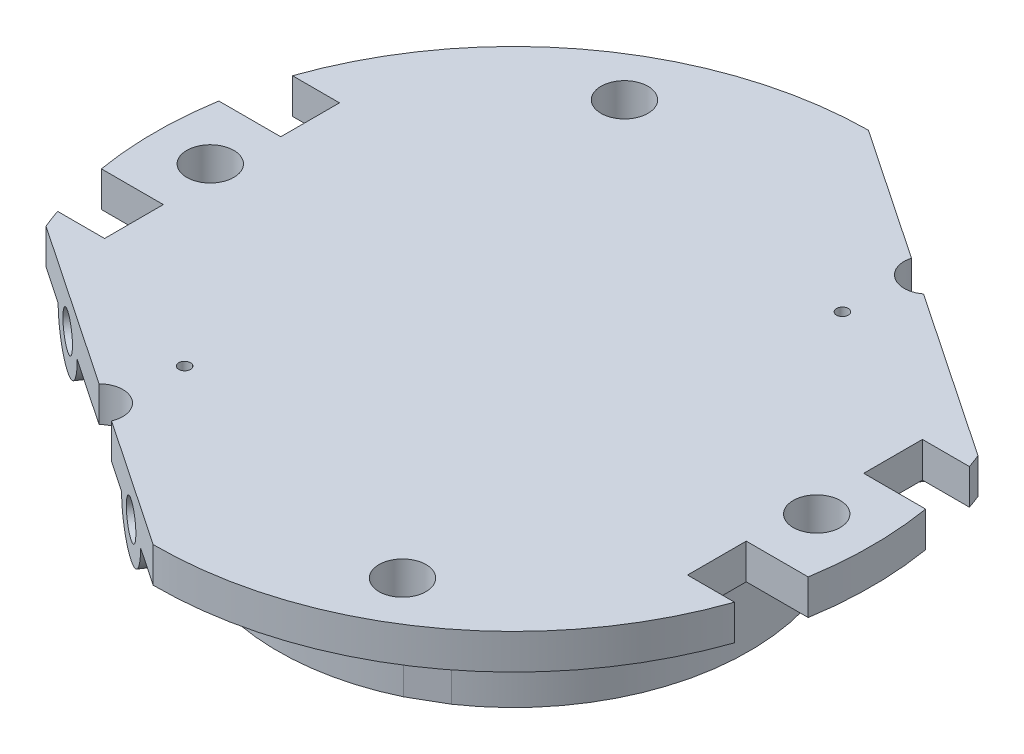
from build123d import *

# Parameters (mm, degrees)
CROQUIS1_R              = 30.5
SALIENTE_EXTRUIR1_DEPTH = 3
CORTAR_EXTRUIR3_START   = -4
CORTAR_EXTRUIR3_DEPTH   = 4
CORTAR_EXTRUIR4_DEPTH   = 10
CROQUIS8_R              = 0.5
CORTAR_EXTRUIR5_DEPTH   = 3
SALIENTE_EXTRUIR2_DEPTH = 13
CROQUIS11_W             = 34.583232932
CROQUIS11_H             = 3
SALIENTE_EXTRUIR3_DEPTH = 6
CROQUIS12_R             = 2
CORTAR_EXTRUIR7_DEPTH   = 3
SALIENTE_EXTRUIR4_DEPTH = 20
CROQUIS14_R             = 1.5
CORTAR_EXTRUIR8_DEPTH   = 6
CORTAR_EXTRUIR9_START   = -3
CORTAR_EXTRUIR9_DEPTH   = 3
CROQUIS16_W             = 33.68877148
CROQUIS16_H             = 3
SALIENTE_EXTRUIR5_DEPTH = 6
CROQUIS17_R             = 2
CORTAR_EXTRUIR10_DEPTH  = 3
CROQUIS18_R             = 3
SALIENTE_EXTRUIR6_DEPTH = 25
CROQUIS19_R             = 1.5
CORTAR_EXTRUIR11_DEPTH  = 5
CORTAR_EXTRUIR12_DEPTH  = 6
CORTAR_EXTRUIR13_DEPTH  = 6
CROQUIS22_R             = 1.5
CORTAR_EXTRUIR14_DEPTH  = 6
CROQUIS23_R             = 1.5
CORTAR_EXTRUIR15_DEPTH  = 6


with BuildPart() as part:
    # Croquis1 → Saliente-Extruir1 (new body)
    with BuildSketch(Plane(origin=(0, 0, 0), x_dir=(1, 0, 0), z_dir=(0, 1, 0))):
        with Locations(Location((0, 0, 0), (0, 0, 270))):
            Circle(CROQUIS1_R)
    extrude(amount=SALIENTE_EXTRUIR1_DEPTH)

    # Croquis5 → Cortar-Extruir3 (cut)
    with BuildSketch(Plane(origin=(0, 3, 0), x_dir=(1, 0, 0), z_dir=(0, 1, 0)).offset(CORTAR_EXTRUIR3_START)):
        with BuildLine():
            ThreePointArc((-30.087372767, -5), (-29.556634924, -7.526973624), (-28.814059068, -10))
            Line((-28.814059068, -10), (-24.814059068, -10))
            Line((-24.814059068, -10), (-24.814059068, -5))
            Line((-24.814059068, -5), (-28.814059068, -5))
            Line((-28.814059068, -5), (-30.087372767, -5))
        make_face()
        with BuildLine():
            ThreePointArc((-28.814059068, 10), (-29.556634924, 7.526973624), (-30.087372767, 5))
            Line((-30.087372767, 5), (-28.814059068, 5))
            Line((-28.814059068, 5), (-24.814059068, 5))
            Line((-24.814059068, 5), (-24.814059068, 10))
            Line((-24.814059068, 10), (-28.814059068, 10))
        make_face()
        with BuildLine():
            Line((28.814059068, 5), (30.087372767, 5))
            ThreePointArc((30.087372767, 5), (29.556634924, 7.526973624), (28.814059068, 10))
            Line((28.814059068, 10), (24.814059068, 10))
            Line((24.814059068, 10), (24.814059068, 5))
            Line((24.814059068, 5), (28.814059068, 5))
        make_face()
        with BuildLine():
            Line((30.087372767, -5), (28.814059068, -5))
            Line((28.814059068, -5), (24.814059068, -5))
            Line((24.814059068, -5), (24.814059068, -10))
            Line((24.814059068, -10), (28.814059068, -10))
            ThreePointArc((28.814059068, -10), (29.556634924, -7.526973624), (30.087372767, -5))
        make_face()
    extrude(amount=CORTAR_EXTRUIR3_DEPTH, mode=Mode.SUBTRACT)

    # Croquis7 → Cortar-Extruir4 (cut)
    with BuildSketch(Plane(origin=(0, 3, 0), x_dir=(1, 0, 0), z_dir=(0, 1, 0))):
        with BuildLine():
            ThreePointArc((-13.907029535, 20.623580122), (-11.907029535, 20.623580122), (-10.907029535, 22.355630929))
            Line((-10.907029535, 22.355630929), (-12.907029535, 22.355630929))
            Line((-12.907029535, 22.355630929), (-13.907029535, 20.623580122))
        make_face()
        with BuildLine():
            Line((-12.907029535, 22.355630929), (-10.907029535, 22.355630929))
            ThreePointArc((-10.907029535, 22.355630929), (-13.907029535, 24.087681737), (-13.907029535, 20.623580122))
            Line((-13.907029535, 20.623580122), (-12.907029535, 22.355630929))
        make_face()
        with BuildLine():
            ThreePointArc((-23.81405907, 0), (-24.082008262, 1), (-24.81405907, 1.732050808))
            Line((-24.81405907, 1.732050808), (-25.81405907, 0))
            Line((-25.81405907, 0), (-24.81405907, -1.732050808))
            ThreePointArc((-24.81405907, -1.732050808), (-24.082008262, -1), (-23.81405907, 0))
        make_face()
        with BuildLine():
            Line((-25.81405907, 0), (-24.81405907, 1.732050808))
            ThreePointArc((-24.81405907, 1.732050808), (-27.81405907, 0), (-24.81405907, -1.732050808))
            Line((-24.81405907, -1.732050808), (-25.81405907, 0))
        make_face()
        with BuildLine():
            ThreePointArc((10.907029535, 22.355630929), (11.907029535, 20.623580122), (13.907029535, 20.623580122))
            Line((13.907029535, 20.623580122), (12.907029535, 22.355630929))
            Line((12.907029535, 22.355630929), (10.907029535, 22.355630929))
        make_face()
        with BuildLine():
            Line((12.907029535, 22.355630929), (13.907029535, 20.623580122))
            ThreePointArc((13.907029535, 20.623580122), (14.639080343, 21.355630929), (14.907029535, 22.355630929))
            ThreePointArc((14.907029535, 22.355630929), (12.907029535, 24.355630929), (10.907029535, 22.355630929))
            Line((10.907029535, 22.355630929), (12.907029535, 22.355630929))
        make_face()
        with BuildLine():
            Line((24.81405907, -1.732050808), (25.81405907, 0))
            Line((25.81405907, 0), (24.81405907, 1.732050808))
            ThreePointArc((24.81405907, 1.732050808), (23.81405907, 0), (24.81405907, -1.732050808))
        make_face()
        with BuildLine():
            Line((24.81405907, 1.732050808), (25.81405907, 0))
            Line((25.81405907, 0), (24.81405907, -1.732050808))
            ThreePointArc((24.81405907, -1.732050808), (26.81405907, -1.732050808), (27.81405907, 0))
            ThreePointArc((27.81405907, 0), (26.81405907, 1.732050808), (24.81405907, 1.732050808))
        make_face()
        with BuildLine():
            ThreePointArc((-13.907029535, -20.623580122), (-13.907029535, -24.087681737), (-10.907029535, -22.355630929))
            Line((-10.907029535, -22.355630929), (-12.907029535, -22.355630929))
            Line((-12.907029535, -22.355630929), (-13.907029535, -20.623580122))
        make_face()
        with BuildLine():
            Line((-12.907029535, -22.355630929), (-10.907029535, -22.355630929))
            ThreePointArc((-10.907029535, -22.355630929), (-11.907029535, -20.623580122), (-13.907029535, -20.623580122))
            Line((-13.907029535, -20.623580122), (-12.907029535, -22.355630929))
        make_face()
        with BuildLine():
            ThreePointArc((14.907029535, -22.355630929), (14.639080343, -21.355630929), (13.907029535, -20.623580122))
            Line((13.907029535, -20.623580122), (12.907029535, -22.355630929))
            Line((12.907029535, -22.355630929), (10.907029535, -22.355630929))
            ThreePointArc((10.907029535, -22.355630929), (12.907029535, -24.355630929), (14.907029535, -22.355630929))
        make_face()
        with BuildLine():
            Line((12.907029535, -22.355630929), (13.907029535, -20.623580122))
            ThreePointArc((13.907029535, -20.623580122), (11.907029535, -20.623580122), (10.907029535, -22.355630929))
            Line((10.907029535, -22.355630929), (12.907029535, -22.355630929))
        make_face()
    extrude(amount=-CORTAR_EXTRUIR4_DEPTH, mode=Mode.SUBTRACT)

    # Croquis8 → Cortar-Extruir5 (cut)
    with BuildSketch(Plane(origin=(0, 3, 0), x_dir=(1, 0, 0), z_dir=(0, 1, 0))):
        with Locations(Location((12, 16, 0), (0, 0, 270))):
            Circle(CROQUIS8_R)
        with Locations(Location((-12, -16, 0), (0, 0, 270))):
            Circle(CROQUIS8_R)
    extrude(amount=-CORTAR_EXTRUIR5_DEPTH, mode=Mode.SUBTRACT)

    # Croquis9 → Saliente-Extruir2 (add)
    with BuildSketch(Plane(origin=(0, 3, 0), x_dir=(1, 0, 0), z_dir=(0, 1, 0))):
        with BuildLine():
            Line((-8.700961894, 18.070508076), (-10, 17.320508076))
            Line((-10, 17.320508076), (-11.299038106, 16.570508076))
            ThreePointArc((-11.299038106, 16.570508076), (-19.960969499, 1.951844427), (-14.294950117, -14.067849912))
            ThreePointArc((-14.294950117, -14.067849912), (-10.97161543, -13.181769141), (-9, -16))
            ThreePointArc((-9, -16), (-9.12838457, -16.868230859), (-9.502549883, -17.662150088))
            ThreePointArc((-9.502549883, -17.662150088), (-0.449805389, -20.05112653), (8.700961894, -18.070508076))
            Line((8.700961894, -18.070508076), (10, -17.320508076))
            Line((10, -17.320508076), (11.299038106, -16.570508076))
            ThreePointArc((11.299038106, -16.570508076), (17.732250869, -9.371087404), (20.05617112, 0))
            ThreePointArc((20.05617112, 0), (18.560064193, 7.600922125), (14.294950117, 14.067849912))
            ThreePointArc((14.294950117, 14.067849912), (10.2, 13.6), (9.502549883, 17.662150088))
            ThreePointArc((9.502549883, 17.662150088), (0.449805389, 20.05112653), (-8.700961894, 18.070508076))
        make_face()
    extrude(amount=-SALIENTE_EXTRUIR2_DEPTH)

    # Croquis11 → Saliente-Extruir3 (add)
    with BuildSketch(Plane(origin=(14.04954782, 0, -20.829311224), x_dir=(-0.8290375725550414, 0, -0.5591929034707472), z_dir=(0.5591929034707472, 0, -0.8290375725550414))):
        with Locations((0, 1.5)):
            Rectangle(CROQUIS11_W, CROQUIS11_H)
    extrude(amount=SALIENTE_EXTRUIR3_DEPTH)

    # Croquis12 → Cortar-Extruir7 (cut)
    with BuildSketch(Plane(origin=(0, 3, 0), x_dir=(1, 0, 0), z_dir=(0, 1, 0))):
        with Locations(Location((12.907029535, 22.355630929, 0), (0, 0, 270))):
            Circle(CROQUIS12_R)
    extrude(amount=-CORTAR_EXTRUIR7_DEPTH, mode=Mode.SUBTRACT)

    # Croquis13 → Saliente-Extruir4 (add)
    with BuildSketch(Plane(origin=(17.404705241, 0, -25.803536659), x_dir=(-0.8290375725550414, 0, -0.5591929034707472), z_dir=(0.5591929034707472, 0, -0.8290375725550414))):
        with BuildLine():
            ThreePointArc((10, 3), (7.878679656, 2.121320344), (7, 0))
            Line((7, 0), (8.5, 0))
            ThreePointArc((8.5, 0), (10, 1.5), (11.5, 0))
            Line((11.5, 0), (13, 0))
            ThreePointArc((13, 0), (12.121320344, 2.121320344), (10, 3))
        make_face()
        with BuildLine():
            Line((8.5, 0), (7, 0))
            ThreePointArc((7, 0), (10, -3), (13, 0))
            Line((13, 0), (11.5, 0))
            ThreePointArc((11.5, 0), (10, -1.5), (8.5, 0))
        make_face()
        with BuildLine():
            ThreePointArc((-11.5, 0), (-10, 1.5), (-8.5, 0))
            Line((-8.5, 0), (-7, 0))
            ThreePointArc((-7, 0), (-7.878679656, 2.121320343), (-9.999999999, 3))
            ThreePointArc((-9.999999999, 3), (-12.121320343, 2.121320344), (-13, 0))
            Line((-13, 0), (-11.5, 0))
        make_face()
        with BuildLine():
            Line((-7, 0), (-8.5, 0))
            ThreePointArc((-8.5, 0), (-10, -1.5), (-11.5, 0))
            Line((-11.5, 0), (-13, 0))
            ThreePointArc((-13, 0), (-10, -3), (-7, 0))
        make_face()
        with BuildLine():
            ThreePointArc((-11.5, 0), (-10, -1.5), (-8.5, 0))
            Line((-8.5, 0), (-11.5, 0))
        make_face()
        with BuildLine():
            Line((-11.5, 0), (-8.5, 0))
            ThreePointArc((-8.5, 0), (-10, 1.5), (-11.5, 0))
        make_face()
        with BuildLine():
            ThreePointArc((11.5, 0), (10, 1.5), (8.5, 0))
            Line((8.5, 0), (11.5, 0))
        make_face()
        with BuildLine():
            Line((11.5, 0), (8.5, 0))
            ThreePointArc((8.5, 0), (10, -1.5), (11.5, 0))
        make_face()
    extrude(amount=-SALIENTE_EXTRUIR4_DEPTH)

    # Croquis14 → Cortar-Extruir8 (cut)
    with BuildSketch(Plane(origin=(17.404705241, 0, -25.803536659), x_dir=(-0.8290375725550414, 0, -0.5591929034707472), z_dir=(0.5591929034707472, 0, -0.8290375725550414))):
        with Locations((-10, 0)):
            Circle(CROQUIS14_R)
        with Locations((10, 0)):
            Circle(CROQUIS14_R)
    extrude(amount=-CORTAR_EXTRUIR8_DEPTH, mode=Mode.SUBTRACT)

    # Croquis15 → Cortar-Extruir9 (cut)
    with BuildSketch(Plane(origin=(0, 3, 0), x_dir=(1, 0, 0), z_dir=(0, 1, 0)).offset(CORTAR_EXTRUIR9_START)):
        with BuildLine():
            ThreePointArc((-28.212513648, -11.588963441), (-17.055383556, -25.285645963), (-0.176506165, -30.499489267))
            Line((-0.176506165, -30.499489267), (-11.071782568, -23.15053254))
            ThreePointArc((-11.071782568, -23.15053254), (-14.025415342, -24.013706075), (-14.331545089, -20.951794957))
            Line((-14.331545089, -20.951794957), (-28.212513648, -11.588963441))
        make_face()
    extrude(amount=CORTAR_EXTRUIR9_DEPTH, mode=Mode.SUBTRACT)

    # Croquis16 → Saliente-Extruir5 (add)
    with BuildSketch(Plane(origin=(-14.194509906, 0, 21.044226354), x_dir=(0.8290375725550415, 0, 0.5591929034707472), z_dir=(-0.5591929034707471, 0, 0.8290375725550414))):
        with Locations((-0.064381976, 1.5)):
            Rectangle(CROQUIS16_W, CROQUIS16_H)
    extrude(amount=SALIENTE_EXTRUIR5_DEPTH)

    # Croquis17 → Cortar-Extruir10 (cut)
    with BuildSketch(Plane(origin=(0, 3, 0), x_dir=(1, 0, 0), z_dir=(0, 1, 0))):
        with Locations(Location((-12.907029535, -22.355630929, 0), (0, 0, 270))):
            Circle(CROQUIS17_R)
    extrude(amount=-CORTAR_EXTRUIR10_DEPTH, mode=Mode.SUBTRACT)

    # Croquis18 → Saliente-Extruir6 (add)
    with BuildSketch(Plane(origin=(-17.549667327, 0, 26.01845179), x_dir=(0.8290375725550416, 0, 0.5591929034707471), z_dir=(-0.5591929034707471, 0, 0.8290375725550416))):
        with Locations((9.935618024, 0)):
            Circle(CROQUIS18_R)
        with Locations((-10.064381976, 0)):
            Circle(CROQUIS18_R)
    extrude(amount=-SALIENTE_EXTRUIR6_DEPTH)

    # Croquis19 → Cortar-Extruir11 (cut)
    with BuildSketch(Plane(origin=(-17.549667327, 0, 26.01845179), x_dir=(0.8290375725550416, 0, 0.5591929034707471), z_dir=(-0.5591929034707471, 0, 0.8290375725550416))):
        with Locations((-10.064381976, 0)):
            Circle(CROQUIS19_R)
        with Locations((9.935618024, 0)):
            Circle(CROQUIS19_R)
    extrude(amount=-CORTAR_EXTRUIR11_DEPTH, mode=Mode.SUBTRACT)

    # Croquis20 → Cortar-Extruir12 (cut)
    with BuildSketch(Plane(origin=(17.404705241, 0, -25.803536659), x_dir=(-0.8290375725550413, 0, -0.5591929034707475), z_dir=(0.5591929034707475, 0, -0.8290375725550414))):
        with BuildLine():
            Line((17.291616466, 3), (17.291616466, 0))
            Line((17.291616466, 0), (13, 0))
            ThreePointArc((13, 0), (10, -3), (7, 0))
            Line((7, 0), (-7, 0))
            ThreePointArc((-7, 0), (-10, -3), (-13, 0))
            Line((-13, 0), (-17.291616466, 0))
            Line((-17.291616466, 0), (-17.291616466, 3))
            Line((-17.291616466, 3), (17.291616466, 3))
        make_face()
    extrude(amount=-CORTAR_EXTRUIR12_DEPTH, mode=Mode.SUBTRACT)

    # Croquis21 → Cortar-Extruir13 (cut)
    with BuildSketch(Plane(origin=(-17.549667327, 0, 26.01845179), x_dir=(0.8290375725550416, 0, 0.5591929034707471), z_dir=(-0.5591929034707471, 0, 0.8290375725550416))):
        with BuildLine():
            Line((-13.064381976, 0), (-16.908767716, 0))
            Line((-16.908767716, 0), (-16.908767716, 3))
            Line((-16.908767716, 3), (16.780003764, 3))
            Line((16.780003764, 3), (16.780003764, 0))
            Line((16.780003764, 0), (12.935618024, 0))
            ThreePointArc((12.935618024, 0), (9.935618024, -3), (6.935618024, 0))
            Line((6.935618024, 0), (-7.064381976, 0))
            ThreePointArc((-7.064381976, 0), (-10.064381976, -3), (-13.064381976, 0))
        make_face()
    extrude(amount=-CORTAR_EXTRUIR13_DEPTH, mode=Mode.SUBTRACT)

    # Croquis22 → Cortar-Extruir14 (cut)
    with BuildSketch(Plane(origin=(-14.194509906, 0, 21.044226354), x_dir=(0.8290375725550415, 0, 0.5591929034707471), z_dir=(-0.5591929034707471, 0, 0.8290375725550415))):
        with Locations((-10.064381976, 0)):
            Circle(CROQUIS22_R)
        with Locations((9.935618024, 0)):
            Circle(CROQUIS22_R)
    extrude(amount=-CORTAR_EXTRUIR14_DEPTH, mode=Mode.SUBTRACT)

    # Croquis23 → Cortar-Extruir15 (cut)
    with BuildSketch(Plane(origin=(14.04954782, 0, -20.829311224), x_dir=(-0.8290375725550414, 0, -0.5591929034707472), z_dir=(0.5591929034707472, 0, -0.8290375725550414))):
        with Locations((-10, 0)):
            Circle(CROQUIS23_R)
        with Locations((10, 0)):
            Circle(CROQUIS23_R)
    extrude(amount=-CORTAR_EXTRUIR15_DEPTH, mode=Mode.SUBTRACT)


solid = part.part
